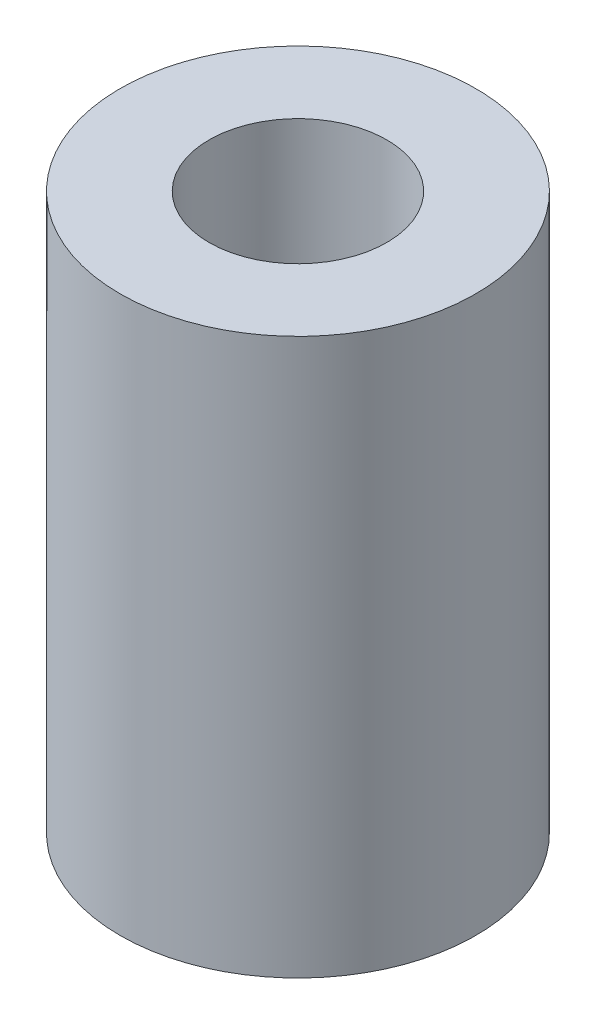
from build123d import *

# Parameters (mm, degrees)
SKETCH1_R           = 8
SKETCH1_R_2         = 4
BOSS_EXTRUDE1_DEPTH = 25


with BuildPart() as part:
    # Sketch1 → Boss-Extrude1 (new body)
    with BuildSketch(Plane(origin=(0, 0, 0), x_dir=(1, 0, 0), z_dir=(0, 1, 0))):
        with Locations(Location((0, 0, 0), (0, 0, 270))):
            Circle(SKETCH1_R)
        with Locations(Location((0, 0, 0), (0, 0, 270))):
            Circle(SKETCH1_R_2, mode=Mode.SUBTRACT)
    extrude(amount=BOSS_EXTRUDE1_DEPTH)


solid = part.part
